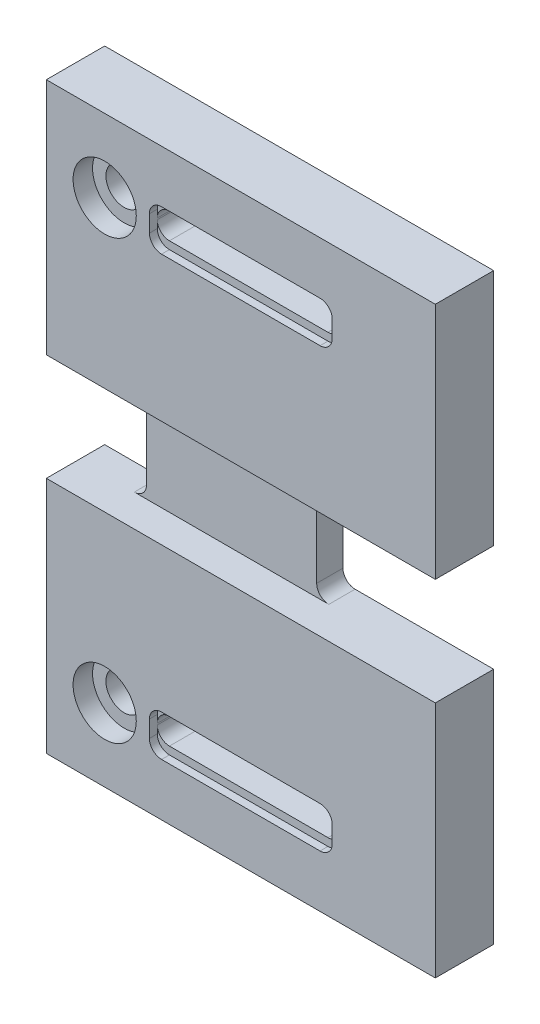
from build123d import *

# Parameters (mm, degrees)
SKETCH1_W           = 76.2
SKETCH1_H           = 50.8
BOSS_EXTRUDE1_DEPTH = 7.62
SKETCH2_W           = 50.8
SKETCH2_H           = 13.97
CUT_EXTRUDE1_DEPTH  = 4.191
SKETCH3_W           = 8.89
SKETCH3_H           = 13.97
SKETCH3_W_2         = 19.685
CUT_EXTRUDE2_DEPTH  = 47.420193882
SKETCH4_R           = 2.38125
CUT_EXTRUDE3_DEPTH  = 47.420193882
SKETCH5_W           = 23.876
SKETCH5_H           = 3.3655
CUT_EXTRUDE4_DEPTH  = 47.420193882
SKETCH6_W           = 23.876
SKETCH6_H           = 1
CUT_EXTRUDE5_DEPTH  = 1.025400032
FILLET3_R           = 1.5875
FILLET6_R           = 1.5875
FILLET7_R           = 1.5875
SKETCH7_R           = 4.1275
CUT_EXTRUDE6_DEPTH  = 2.54


with BuildPart() as part:
    # Sketch1 → Boss-Extrude1 (new body)
    with BuildSketch(Plane(origin=(0, 0, 0), x_dir=(0, 1, 0), z_dir=(0, 0, 1))):
        Rectangle(SKETCH1_W, SKETCH1_H)
    extrude(amount=BOSS_EXTRUDE1_DEPTH)

    # Sketch2 → Cut-Extrude1 (cut)
    with BuildSketch(Plane.XY.offset(7.62)):
        Rectangle(SKETCH2_W, SKETCH2_H)
    extrude(amount=-CUT_EXTRUDE1_DEPTH, mode=Mode.SUBTRACT)

    # Sketch3 → Cut-Extrude2 (cut, through all)
    with BuildSketch(Plane(origin=(0, 0, 0), x_dir=(1, 0, 0), z_dir=(0, 0, -1))):
        with Locations((-20.955, 0)):
            Rectangle(SKETCH3_W, SKETCH3_H)
        with Locations((15.5575, 0)):
            Rectangle(SKETCH3_W_2, SKETCH3_H)
    extrude(amount=-CUT_EXTRUDE2_DEPTH, mode=Mode.SUBTRACT)

    # Sketch4 → Cut-Extrude3 (cut, through all)
    with BuildSketch(Plane.XY.offset(7.62)):
        with Locations((-17.78, 28.575)):
            Circle(SKETCH4_R)
        with Locations((-17.78, -28.575)):
            Circle(SKETCH4_R)
    extrude(amount=-CUT_EXTRUDE3_DEPTH, mode=Mode.SUBTRACT)

    # Sketch5 → Cut-Extrude4 (cut, through all)
    with BuildSketch(Plane.XY.offset(7.62)):
        with Locations((0, 28.575)):
            Rectangle(SKETCH5_W, SKETCH5_H)
        with Locations((0, -28.575)):
            Rectangle(SKETCH5_W, SKETCH5_H)
    extrude(amount=-CUT_EXTRUDE4_DEPTH, mode=Mode.SUBTRACT)

    # Sketch6 → Cut-Extrude5 (cut)
    with BuildSketch(Plane.XY.offset(7.62)):
        with Locations((0, 26.39225)):
            Rectangle(SKETCH6_W, SKETCH6_H)
        with Locations((0, -26.39225)):
            Rectangle(SKETCH6_W, SKETCH6_H)
        with Locations((0, 30.75775)):
            Rectangle(SKETCH6_W, SKETCH6_H)
        with Locations((0, -30.75775)):
            Rectangle(SKETCH6_W, SKETCH6_H)
    extrude(amount=-CUT_EXTRUDE5_DEPTH, mode=Mode.SUBTRACT)

    # Fillet3
    fillet3_edges = [part.edges().sort_by_distance(p)[0] for p in [
        (-16.51, 6.985, 1.7145),
        (-16.51, -6.985, 1.7145),
        (5.715, -6.985, 1.7145),
        (5.715, 6.985, 1.7145),
    ]]
    fillet(fillet3_edges, radius=FILLET3_R)

    # Fillet6
    fillet6_edges = [part.edges().sort_by_distance(p)[0] for p in [
        (-11.938, 30.25775, 3.297299984),
        (11.938, 30.25775, 3.297299984),
        (11.938, 26.89225, 3.297299984),
        (-11.938, 26.89225, 3.297299984),
        (-11.938, -26.89225, 3.297299984),
        (11.938, -26.89225, 3.297299984),
        (11.938, -30.25775, 3.297299984),
        (-11.938, -30.25775, 3.297299984),
    ]]
    fillet(fillet6_edges, radius=FILLET6_R)

    # Fillet7
    fillet7_edges = [part.edges().sort_by_distance(p)[0] for p in [
        (11.938, -31.25775, 7.107299984),
        (-11.938, -31.25775, 7.107299984),
        (-11.938, -25.89225, 7.107299984),
        (11.938, -25.89225, 7.107299984),
        (-11.938, 31.25775, 7.107299984),
        (11.938, 31.25775, 7.107299984),
        (11.938, 25.89225, 7.107299984),
        (-11.938, 25.89225, 7.107299984),
    ]]
    fillet(fillet7_edges, radius=FILLET7_R)

    # Sketch7 → Cut-Extrude6 (cut)
    with BuildSketch(Plane.XY.offset(7.62)):
        with Locations((-17.78, -28.575)):
            Circle(SKETCH7_R)
        with Locations((-17.78, 28.575)):
            Circle(SKETCH7_R)
    extrude(amount=-CUT_EXTRUDE6_DEPTH, mode=Mode.SUBTRACT)


solid = part.part
